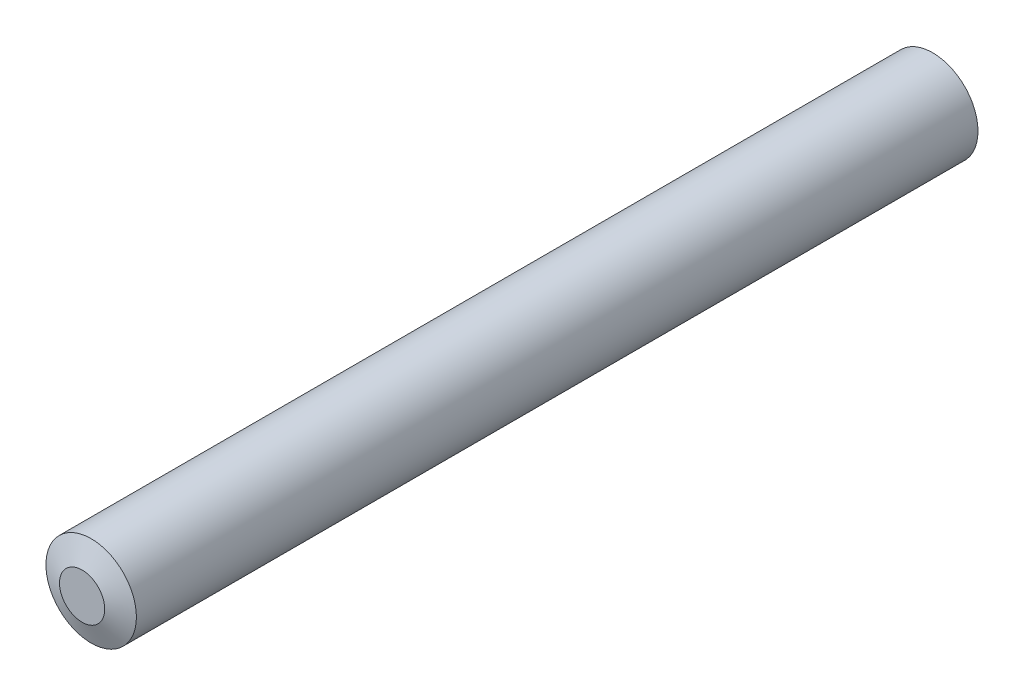
from build123d import *

# Parameters (mm, degrees)
SKETCH_1_R      = 2
EXTRUDE_1_DEPTH = 19
CHAMFER_1_SIZE  = 0.4
CHAMFER_1_SIZE2 = 1
CHAMFER_2_SIZE  = 1
CHAMFER_2_SIZE2 = 0.4


with BuildPart() as part:
    # 草图1 → 拉伸1 (new, symmetric)
    with BuildSketch(Plane.XY):
        Circle(SKETCH_1_R)
    extrude(amount=EXTRUDE_1_DEPTH, both=True)

    # 倒角1
    chamfer_1_edges = [part.edges().sort_by_distance(p)[0] for p in [
        (-2, 0, 19),
    ]]
    chamfer_1_side = [part.faces().sort_by_distance(p)[0] for p in [
        (-2, 0, 0),
    ]]
    chamfer(chamfer_1_edges, length=CHAMFER_1_SIZE, length2=CHAMFER_1_SIZE2, reference=chamfer_1_side[0])

    # 倒角2
    chamfer_2_edges = [part.edges().sort_by_distance(p)[0] for p in [
        (-2, 0, -19),
    ]]
    chamfer_2_side = [part.faces().sort_by_distance(p)[0] for p in [
        (0, 0, -19),
    ]]
    chamfer(chamfer_2_edges, length=CHAMFER_2_SIZE, length2=CHAMFER_2_SIZE2, reference=chamfer_2_side[0])


solid = part.part
